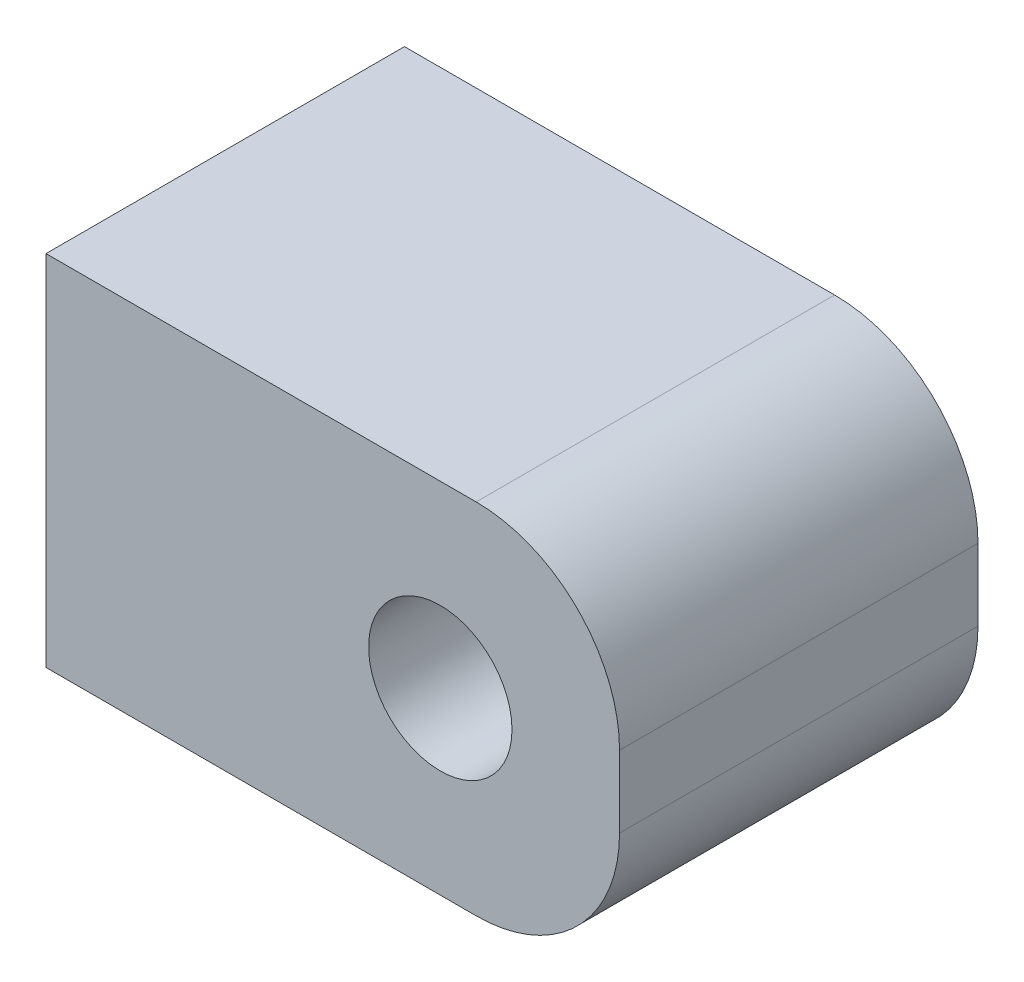
from build123d import *

# Parameters (mm, degrees)
SKETCH1_W           = 8
SKETCH1_H           = 5
BOSS_EXTRUDE1_DEPTH = 5
SKETCH2_R           = 1
CUT_EXTRUDE1_DEPTH  = 4
SKETCH3_R           = 1
CUT_EXTRUDE4_DEPTH  = 5
FILLET1_R           = 2


with BuildPart() as part:
    # Sketch1 → Boss-Extrude1 (new body)
    with BuildSketch(Plane.XY):
        with Locations((4, 2.5)):
            Rectangle(SKETCH1_W, SKETCH1_H)
    extrude(amount=BOSS_EXTRUDE1_DEPTH)

    # Sketch2 → Cut-Extrude1 (cut)
    with BuildSketch(Plane.ZY):
        with Locations((2.5, 2.5)):
            Circle(SKETCH2_R)
    extrude(amount=-CUT_EXTRUDE1_DEPTH, mode=Mode.SUBTRACT)

    # Sketch3 → Cut-Extrude4 (cut)
    with BuildSketch(Plane.XY.offset(5)):
        with Locations((5.5, 2.5)):
            Circle(SKETCH3_R)
    extrude(amount=-CUT_EXTRUDE4_DEPTH, mode=Mode.SUBTRACT)

    # Fillet1
    fillet1_edges = [part.edges().sort_by_distance(p)[0] for p in [
        (8, 5, 2.5),
        (8, 0, 2.5),
    ]]
    fillet(fillet1_edges, radius=FILLET1_R)


solid = part.part
